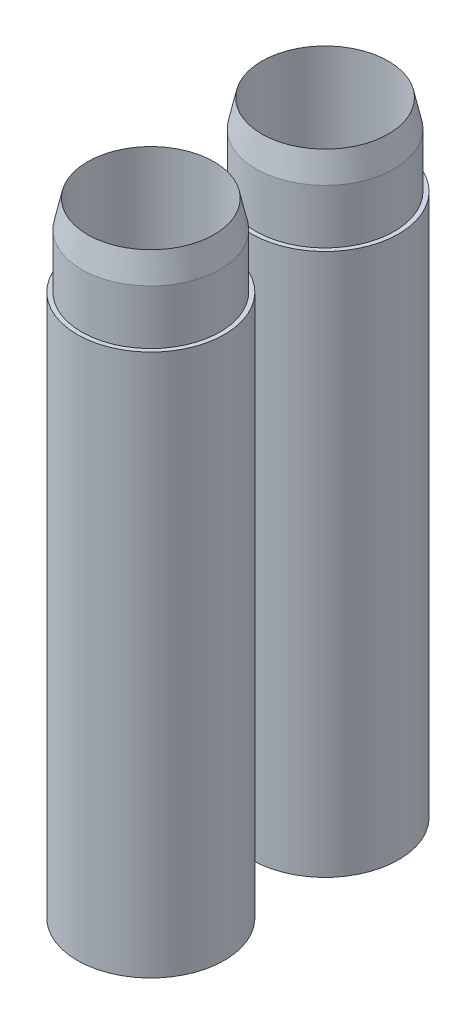
from build123d import *

# Parameters (mm, degrees)
SKETCH1_R               = 27.15
MANDREL_DEPTH           = 200
TAB_ANGLE               = 5
CUT_EXTRUDE1_DEPTH      = 234.182857432
CUT_EXTRUDE1_DEPTH_BACK = 234.182857432
LPATTERN1_COUNT         = 2
LPATTERN1_PITCH         = 64.3


with BuildPart() as part:
    # Sketch1 → mandrel (new body)
    with BuildSketch(Plane(origin=(0, 0, 0), x_dir=(1, 0, 0), z_dir=(0, 1, 0))):
        Circle(SKETCH1_R)
        with BuildLine():
            Line((-26.75, 0), (-25.427396642, 2.5))
            ThreePointArc((-25.427396642, 2.5), (25.55, 0), (-25.427396642, -2.5))
            Line((-25.427396642, -2.5), (-26.75, 0))
        make_face(mode=Mode.SUBTRACT)
    extrude(amount=MANDREL_DEPTH)

    # Sketch4 → coupler (revolve)
    with BuildSketch(Plane(origin=(0, 0, 0), x_dir=(-1, 0, 0), z_dir=(0, 0, -1))):
        Polygon((-23.333053374, 192.216946626), (-23.333053374, 230), (-25.55, 220), (-25.55, 190), align=None)
    revolve(axis=Axis((0, 200, 0), (0, -1, 0)))

    # Sketch5 → Cut-Extrude1 (cut, two sides: drawn at the far end of the back side and taken through both)
    with BuildSketch(Plane.XZ.offset(-CUT_EXTRUDE1_DEPTH_BACK)):
        Polygon((-25.427396642, 2.5), (-26.75, 0), (-25.427396642, -2.5), align=None)
    extrude(amount=CUT_EXTRUDE1_DEPTH + CUT_EXTRUDE1_DEPTH_BACK, mode=Mode.SUBTRACT)


with BuildPart() as body_2:
    # Sketch3 → tab (revolve)
    with BuildSketch(Plane(origin=(0, 0, 0), x_dir=(-0.9952014341371682, 0, 0.0978473581213308), z_dir=(-0.0978473581213308, 0, -0.9952014341371682))):
        Polygon((25.55, 0), (20.55, 8.660254038), (20.55, 18.660254038), (25.55, 27.320508076), align=None)
    revolve(axis=Axis((0, 200, 0), (0, 1, 0)), revolution_arc=TAB_ANGLE)


with BuildPart() as lpattern1_1:
    # LPattern1: pattern copy
    add(part.part.moved(Location(Vector(0, 0, 1) * (1 * LPATTERN1_PITCH))))


solid = Compound([part.part, body_2.part, lpattern1_1.part])
